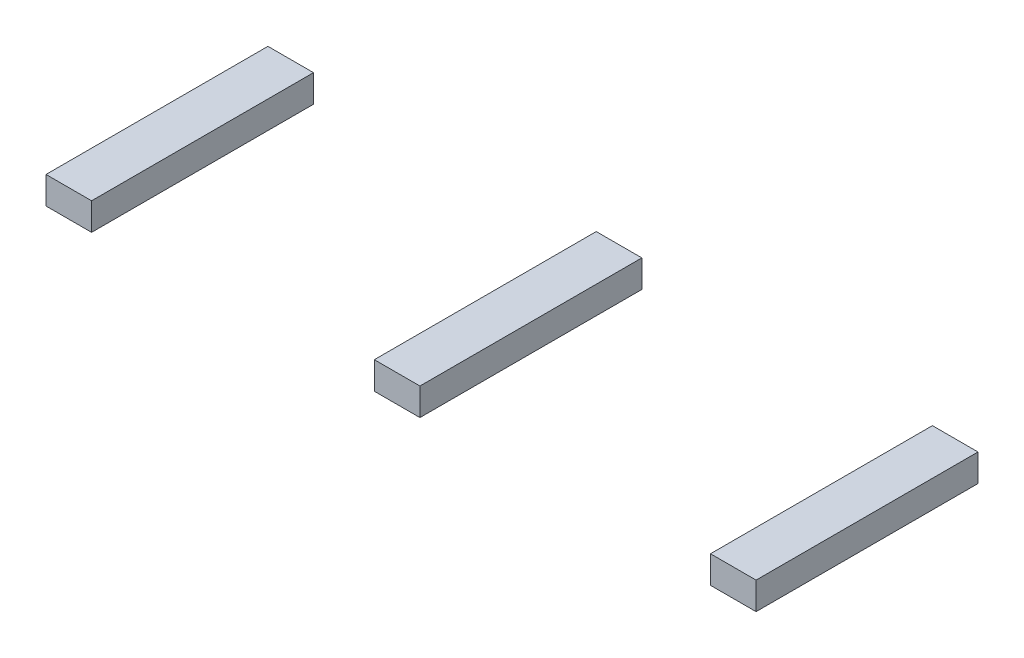
from build123d import *

# Parameters (mm, degrees)
CROQUIS1_W                = 0.75
CROQUIS1_H                = 0.45
SALIENTE_EXTRUIR1_DEPTH   = 3.65
SALIENTE_EXTRUIR1_2_DEPTH = 3.65
SALIENTE_EXTRUIR1_3_DEPTH = 3.65


with BuildPart() as part:
    # Croquis1 → Saliente-Extruir1 (new body)
    with BuildSketch(Plane.XY):
        with Locations((-5.400229137, -0.061703165)):
            Rectangle(CROQUIS1_W, CROQUIS1_H)
    extrude(amount=SALIENTE_EXTRUIR1_DEPTH)


with BuildPart() as body_2:
    # Croquis1 → Saliente-Extruir1 2 (new body)
    with BuildSketch(Plane.XY):
        Rectangle(CROQUIS1_W, CROQUIS1_H)
    extrude(amount=SALIENTE_EXTRUIR1_2_DEPTH)


with BuildPart() as body_3:
    # Croquis1 → Saliente-Extruir1 3 (new body)
    with BuildSketch(Plane.XY):
        with Locations((5.528878755, 0)):
            Rectangle(CROQUIS1_W, CROQUIS1_H)
    extrude(amount=SALIENTE_EXTRUIR1_3_DEPTH)


solid = Compound([part.part, body_2.part, body_3.part])
